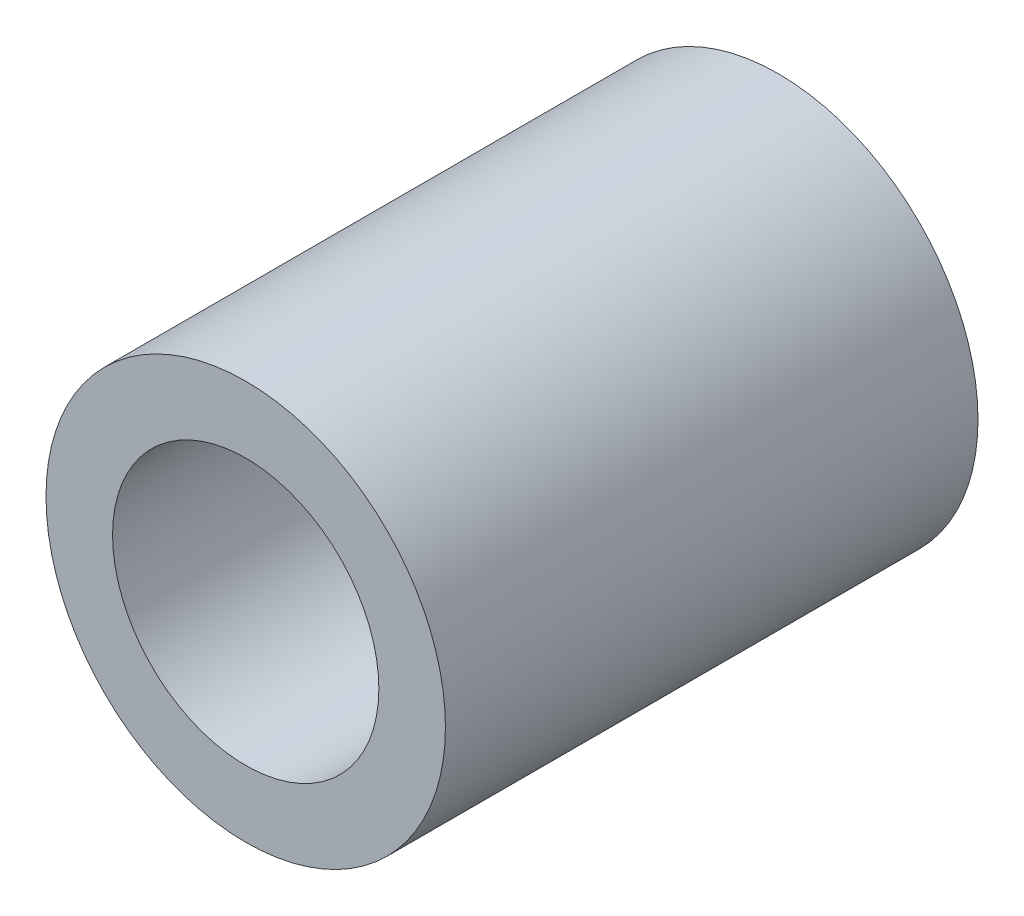
from build123d import *

# Parameters (mm, degrees)
ESQUISSE1_R             = 19.05
BOSS_EXTRU_1_DEPTH      = 50.8
ESQUISSE4_R             = 12.7
ENL_V_MAT_EXTRU_1_DEPTH = 43.45
ESQUISSE5_R             = 6.35
ENL_V_MAT_EXTRU_3_DEPTH = 7.35


with BuildPart() as part:
    # Esquisse1 → Boss.-Extru.1 (new body)
    with BuildSketch(Plane.XY):
        Circle(ESQUISSE1_R)
    extrude(amount=BOSS_EXTRU_1_DEPTH)

    # Esquisse4 → Enlèv. mat.-Extru.1 (cut)
    with BuildSketch(Plane.XY.offset(50.8)):
        Circle(ESQUISSE4_R)
    extrude(amount=-ENL_V_MAT_EXTRU_1_DEPTH, mode=Mode.SUBTRACT)

    # Esquisse5 → Enlèv. mat.-Extru.3 (cut)
    with BuildSketch(Plane(origin=(0, 0, 0), x_dir=(-1, 0, 0), z_dir=(0, 0, -1))):
        Circle(ESQUISSE5_R)
    extrude(amount=-ENL_V_MAT_EXTRU_3_DEPTH, mode=Mode.SUBTRACT)


solid = part.part
